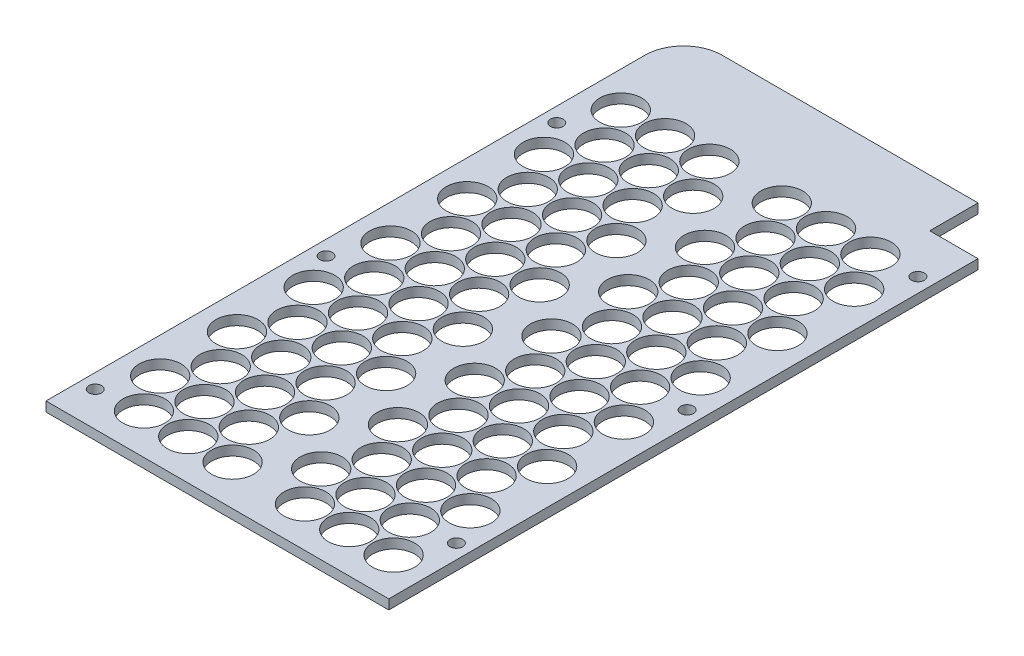
from build123d import *

# Parameters (mm, degrees)
CELL_BLOCK_SKETCH_W = 162.5
CELL_BLOCK_SKETCH_H = 305.12867922
BOSS_EXTRUDE1_DEPTH = 5
SKETCH3_W           = 7.5
SKETCH3_H           = 305.12867922
BOSS_EXTRUDE2_DEPTH = 5
HOLE_PATTERN_R      = 10.875
CUT_EXTRUDE1_DEPTH  = 5
SKETCH4_R           = 3.3
CUT_EXTRUDE2_DEPTH  = 5
SKETCH5_W           = 152.5
SKETCH5_H           = 25
BOSS_EXTRUDE3_DEPTH = 5
FILLET1_R           = 20


with BuildPart() as part:
    # Cell Block Sketch → Boss-Extrude1 (new body)
    with BuildSketch(Plane(origin=(0, 0, 0), x_dir=(1, 0, 0), z_dir=(0, 1, 0))):
        Rectangle(CELL_BLOCK_SKETCH_W, CELL_BLOCK_SKETCH_H)
    extrude(amount=BOSS_EXTRUDE1_DEPTH)

    # Sketch3 → Boss-Extrude2 (add)
    with BuildSketch(Plane(origin=(0, 0, 0), x_dir=(1, 0, 0), z_dir=(0, 1, 0))):
        with Locations((-85, 0)):
            Rectangle(SKETCH3_W, SKETCH3_H)
    boss_extrude2 = extrude(amount=BOSS_EXTRUDE2_DEPTH)

    # Mirror1: Boss-Extrude2 across plane
    add(boss_extrude2.mirror(Plane(origin=(0, 0, 0), x_dir=(0, 0, 1), z_dir=(1, 0, 0))))

    # Hole Pattern → Cut-Extrude1 (cut)
    with BuildSketch(Plane(origin=(0, 5, 0), x_dir=(1, 0, 0), z_dir=(0, 1, 0))):
        with Locations(Location((-70.375, -111.814056593, 0), (0, 0, 270))):
            Circle(HOLE_PATTERN_R)
        with Locations(Location((-58.9, -131.68933961, 0), (0, 0, 270))):
            Circle(HOLE_PATTERN_R)
        with Locations(Location((-70.375, -72.063490559, 0), (0, 0, 270))):
            Circle(HOLE_PATTERN_R)
        with Locations(Location((-58.9, -91.938773576, 0), (0, 0, 270))):
            Circle(HOLE_PATTERN_R)
        with Locations(Location((-70.375, -32.312924525, 0), (0, 0, 270))):
            Circle(HOLE_PATTERN_R)
        with Locations(Location((-58.9, -52.188207542, 0), (0, 0, 270))):
            Circle(HOLE_PATTERN_R)
        with Locations(Location((-70.375, 7.437641508, 0), (0, 0, 270))):
            Circle(HOLE_PATTERN_R)
        with Locations(Location((-58.9, -12.437641508, 0), (0, 0, 270))):
            Circle(HOLE_PATTERN_R)
        with Locations(Location((-70.375, 47.188207542, 0), (0, 0, 270))):
            Circle(HOLE_PATTERN_R)
        with Locations(Location((-58.9, 27.312924525, 0), (0, 0, 270))):
            Circle(HOLE_PATTERN_R)
        with Locations(Location((-70.375, 86.938773576, 0), (0, 0, 270))):
            Circle(HOLE_PATTERN_R)
        with Locations(Location((-58.9, 67.063490559, 0), (0, 0, 270))):
            Circle(HOLE_PATTERN_R)
        with Locations(Location((-70.375, 126.68933961, 0), (0, 0, 270))):
            Circle(HOLE_PATTERN_R)
        with Locations(Location((-58.9, 106.814056593, 0), (0, 0, 270))):
            Circle(HOLE_PATTERN_R)
        with Locations(Location((-47.425, -72.063490559, 0), (0, 0, 270))):
            Circle(HOLE_PATTERN_R)
        with Locations(Location((-35.95, -91.938773576, 0), (0, 0, 270))):
            Circle(HOLE_PATTERN_R)
        with Locations(Location((-47.425, -32.312924525, 0), (0, 0, 270))):
            Circle(HOLE_PATTERN_R)
        with Locations(Location((-35.95, -52.188207542, 0), (0, 0, 270))):
            Circle(HOLE_PATTERN_R)
        with Locations(Location((-47.425, 7.437641508, 0), (0, 0, 270))):
            Circle(HOLE_PATTERN_R)
        with Locations(Location((-35.95, -12.437641508, 0), (0, 0, 270))):
            Circle(HOLE_PATTERN_R)
        with Locations(Location((-47.425, 47.188207542, 0), (0, 0, 270))):
            Circle(HOLE_PATTERN_R)
        with Locations(Location((-35.95, 27.312924525, 0), (0, 0, 270))):
            Circle(HOLE_PATTERN_R)
        with Locations(Location((-47.425, 86.938773576, 0), (0, 0, 270))):
            Circle(HOLE_PATTERN_R)
        with Locations(Location((-35.95, 67.063490559, 0), (0, 0, 270))):
            Circle(HOLE_PATTERN_R)
        with Locations(Location((-47.425, 126.68933961, 0), (0, 0, 270))):
            Circle(HOLE_PATTERN_R)
        with Locations(Location((-35.95, 106.814056593, 0), (0, 0, 270))):
            Circle(HOLE_PATTERN_R)
        with Locations(Location((-24.475, -72.063490559, 0), (0, 0, 270))):
            Circle(HOLE_PATTERN_R)
        with Locations(Location((-13, -91.938773576, 0), (0, 0, 270))):
            Circle(HOLE_PATTERN_R)
        with Locations(Location((-24.475, -32.312924525, 0), (0, 0, 270))):
            Circle(HOLE_PATTERN_R)
        with Locations(Location((-13, -52.188207542, 0), (0, 0, 270))):
            Circle(HOLE_PATTERN_R)
        with Locations(Location((-24.475, 7.437641508, 0), (0, 0, 270))):
            Circle(HOLE_PATTERN_R)
        with Locations(Location((-13, -12.437641508, 0), (0, 0, 270))):
            Circle(HOLE_PATTERN_R)
        with Locations(Location((-24.475, 47.188207542, 0), (0, 0, 270))):
            Circle(HOLE_PATTERN_R)
        with Locations(Location((-13, 27.312924525, 0), (0, 0, 270))):
            Circle(HOLE_PATTERN_R)
        with Locations(Location((-24.475, 86.938773576, 0), (0, 0, 270))):
            Circle(HOLE_PATTERN_R)
        with Locations(Location((-13, 67.063490559, 0), (0, 0, 270))):
            Circle(HOLE_PATTERN_R)
        with Locations(Location((-24.475, 126.68933961, 0), (0, 0, 270))):
            Circle(HOLE_PATTERN_R)
        with Locations(Location((-13, 106.814056593, 0), (0, 0, 270))):
            Circle(HOLE_PATTERN_R)
        with Locations(Location((-47.425, -111.814056593, 0), (0, 0, 270))):
            Circle(HOLE_PATTERN_R)
        with Locations(Location((-35.95, -131.68933961, 0), (0, 0, 270))):
            Circle(HOLE_PATTERN_R)
        with Locations(Location((-24.475, -111.814056593, 0), (0, 0, 270))):
            Circle(HOLE_PATTERN_R)
        with Locations(Location((-13, -131.68933961, 0), (0, 0, 270))):
            Circle(HOLE_PATTERN_R)
        with Locations(Location((70.375, -131.68933961, 0), (0, 0, 270))):
            Circle(HOLE_PATTERN_R)
        with Locations(Location((58.9, -111.814056593, 0), (0, 0, 270))):
            Circle(HOLE_PATTERN_R)
        with Locations(Location((35.95, -111.814056593, 0), (0, 0, 270))):
            Circle(HOLE_PATTERN_R)
        with Locations(Location((47.425, -131.68933961, 0), (0, 0, 270))):
            Circle(HOLE_PATTERN_R)
        with Locations(Location((13, -111.814056593, 0), (0, 0, 270))):
            Circle(HOLE_PATTERN_R)
        with Locations(Location((24.475, -131.68933961, 0), (0, 0, 270))):
            Circle(HOLE_PATTERN_R)
        with Locations(Location((35.95, -72.063490559, 0), (0, 0, 270))):
            Circle(HOLE_PATTERN_R)
        with Locations(Location((47.425, -91.938773576, 0), (0, 0, 270))):
            Circle(HOLE_PATTERN_R)
        with Locations(Location((13, -72.063490559, 0), (0, 0, 270))):
            Circle(HOLE_PATTERN_R)
        with Locations(Location((24.475, -91.938773576, 0), (0, 0, 270))):
            Circle(HOLE_PATTERN_R)
        with Locations(Location((35.95, -32.312924525, 0), (0, 0, 270))):
            Circle(HOLE_PATTERN_R)
        with Locations(Location((47.425, -52.188207542, 0), (0, 0, 270))):
            Circle(HOLE_PATTERN_R)
        with Locations(Location((13, -32.312924525, 0), (0, 0, 270))):
            Circle(HOLE_PATTERN_R)
        with Locations(Location((24.475, -52.188207542, 0), (0, 0, 270))):
            Circle(HOLE_PATTERN_R)
        with Locations(Location((35.95, 7.437641508, 0), (0, 0, 270))):
            Circle(HOLE_PATTERN_R)
        with Locations(Location((47.425, -12.437641508, 0), (0, 0, 270))):
            Circle(HOLE_PATTERN_R)
        with Locations(Location((13, 7.437641508, 0), (0, 0, 270))):
            Circle(HOLE_PATTERN_R)
        with Locations(Location((24.475, -12.437641508, 0), (0, 0, 270))):
            Circle(HOLE_PATTERN_R)
        with Locations(Location((35.95, 47.188207542, 0), (0, 0, 270))):
            Circle(HOLE_PATTERN_R)
        with Locations(Location((47.425, 27.312924525, 0), (0, 0, 270))):
            Circle(HOLE_PATTERN_R)
        with Locations(Location((13, 47.188207542, 0), (0, 0, 270))):
            Circle(HOLE_PATTERN_R)
        with Locations(Location((24.475, 27.312924525, 0), (0, 0, 270))):
            Circle(HOLE_PATTERN_R)
        with Locations(Location((35.95, 86.938773576, 0), (0, 0, 270))):
            Circle(HOLE_PATTERN_R)
        with Locations(Location((47.425, 67.063490559, 0), (0, 0, 270))):
            Circle(HOLE_PATTERN_R)
        with Locations(Location((13, 86.938773576, 0), (0, 0, 270))):
            Circle(HOLE_PATTERN_R)
        with Locations(Location((24.475, 67.063490559, 0), (0, 0, 270))):
            Circle(HOLE_PATTERN_R)
        with Locations(Location((35.95, 126.68933961, 0), (0, 0, 270))):
            Circle(HOLE_PATTERN_R)
        with Locations(Location((47.425, 106.814056593, 0), (0, 0, 270))):
            Circle(HOLE_PATTERN_R)
        with Locations(Location((13, 126.68933961, 0), (0, 0, 270))):
            Circle(HOLE_PATTERN_R)
        with Locations(Location((24.475, 106.814056593, 0), (0, 0, 270))):
            Circle(HOLE_PATTERN_R)
        with Locations(Location((58.9, -72.063490559, 0), (0, 0, 270))):
            Circle(HOLE_PATTERN_R)
        with Locations(Location((70.375, -91.938773576, 0), (0, 0, 270))):
            Circle(HOLE_PATTERN_R)
        with Locations(Location((58.9, -32.312924525, 0), (0, 0, 270))):
            Circle(HOLE_PATTERN_R)
        with Locations(Location((70.375, -52.188207542, 0), (0, 0, 270))):
            Circle(HOLE_PATTERN_R)
        with Locations(Location((58.9, 7.437641508, 0), (0, 0, 270))):
            Circle(HOLE_PATTERN_R)
        with Locations(Location((70.375, -12.437641508, 0), (0, 0, 270))):
            Circle(HOLE_PATTERN_R)
        with Locations(Location((58.9, 47.188207542, 0), (0, 0, 270))):
            Circle(HOLE_PATTERN_R)
        with Locations(Location((70.375, 27.312924525, 0), (0, 0, 270))):
            Circle(HOLE_PATTERN_R)
        with Locations(Location((58.9, 86.938773576, 0), (0, 0, 270))):
            Circle(HOLE_PATTERN_R)
        with Locations(Location((70.375, 67.063490559, 0), (0, 0, 270))):
            Circle(HOLE_PATTERN_R)
        with Locations(Location((58.9, 126.68933961, 0), (0, 0, 270))):
            Circle(HOLE_PATTERN_R)
        with Locations(Location((70.375, 106.814056593, 0), (0, 0, 270))):
            Circle(HOLE_PATTERN_R)
    extrude(amount=-CUT_EXTRUDE1_DEPTH, mode=Mode.SUBTRACT)

    # Sketch4 → Cut-Extrude2 (cut)
    with BuildSketch(Plane(origin=(0, 5, 0), x_dir=(1, 0, 0), z_dir=(0, 1, 0))):
        with Locations(Location((-81.25, 104.43566039, 0), (0, 0, 270))):
            Circle(SKETCH4_R)
        with Locations(Location((-81.25, -15.06433961, 0), (0, 0, 270))):
            Circle(SKETCH4_R)
        with Locations(Location((-81.25, -134.56433961, 0), (0, 0, 270))):
            Circle(SKETCH4_R)
        with Locations(Location((81.25, -110.06433961, 0), (0, 0, 270))):
            Circle(SKETCH4_R)
        with Locations(Location((81.25, 9.43566039, 0), (0, 0, 270))):
            Circle(SKETCH4_R)
        with Locations(Location((81.25, 128.93566039, 0), (0, 0, 270))):
            Circle(SKETCH4_R)
    extrude(amount=-CUT_EXTRUDE2_DEPTH, mode=Mode.SUBTRACT)

    # Sketch5 → Boss-Extrude3 (add)
    with BuildSketch(Plane(origin=(0, 0, 0), x_dir=(1, 0, 0), z_dir=(0, 1, 0))):
        with Locations((-12.5, 165.06433961)):
            Rectangle(SKETCH5_W, SKETCH5_H)
    extrude(amount=BOSS_EXTRUDE3_DEPTH)

    # Fillet1
    fillet1_edges = [part.edges().sort_by_distance(p)[0] for p in [
        (-88.75, 2.5, -177.56433961),
    ]]
    fillet(fillet1_edges, radius=FILLET1_R)


solid = part.part
